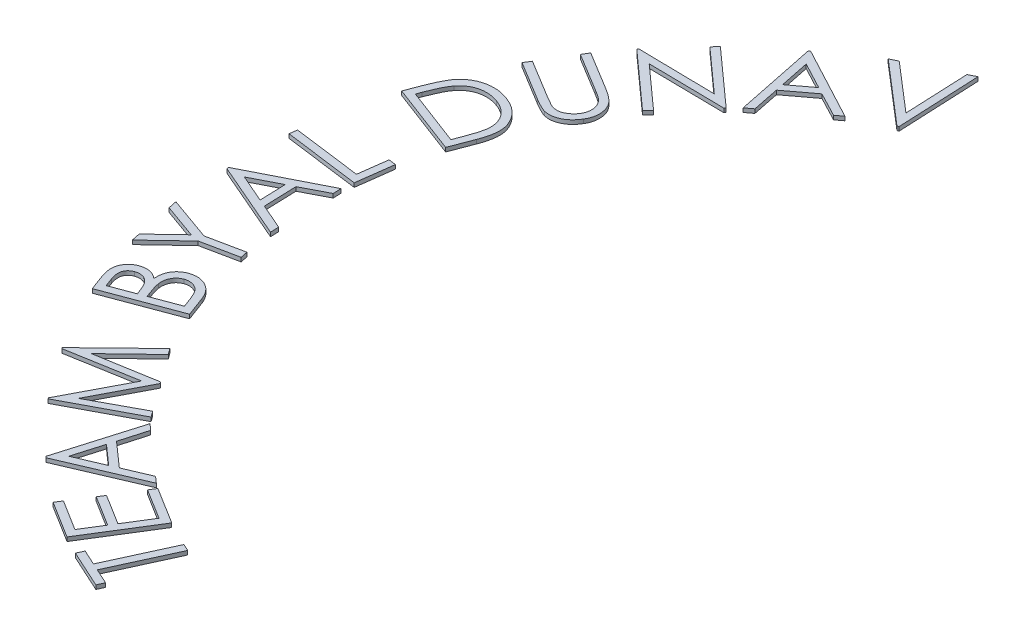
from build123d import *

# Parameters (mm, degrees)
BOSS_EXTRUDE1_DEPTH    = 1
BOSS_EXTRUDE1_2_DEPTH  = 1
BOSS_EXTRUDE1_3_DEPTH  = 1
BOSS_EXTRUDE1_4_DEPTH  = 1
BOSS_EXTRUDE1_5_DEPTH  = 1
BOSS_EXTRUDE1_6_DEPTH  = 1
BOSS_EXTRUDE1_7_DEPTH  = 1
BOSS_EXTRUDE1_8_DEPTH  = 1
BOSS_EXTRUDE1_9_DEPTH  = 1
BOSS_EXTRUDE1_10_DEPTH = 1
BOSS_EXTRUDE1_11_DEPTH = 1
BOSS_EXTRUDE1_12_DEPTH = 1
BOSS_EXTRUDE1_13_DEPTH = 1


with BuildPart() as part:
    # Sketch2 → Boss-Extrude1 (new body)
    with BuildSketch(Plane(origin=(0, 0, 0), x_dir=(1, 0, 0), z_dir=(0, 1, 0))):
        Polygon((-59.509999225, 102.840676539), (-57.659187927, 103.748909712), (-45.585029273, 93.353837597), (-46.287192735, 109.320424135), (-44.436381437, 110.224841202), (-43.505251629, 89.583525097), (-43.875413889, 89.40035202), align=None)
    extrude(amount=BOSS_EXTRUDE1_DEPTH)


with BuildPart() as body_2:
    # Sketch2 → Boss-Extrude1 2 (new body)
    with BuildSketch(Plane(origin=(0, 0, 0), x_dir=(1, 0, 0), z_dir=(0, 1, 0))):
        Polygon((-70.882797595, 94.826390165), (-52.515880527, 85.026630549), (-54.137725479, 83.809292809), (-60.235862499, 86.99192502), (-66.734690624, 82.111125742), (-65.368524758, 75.375699059), (-67.047611297, 74.112568049), (-71.249143749, 94.551630549), align=None)
        Polygon((-68.661824037, 91.491113722), (-67.150646152, 84.072604107), (-61.991271152, 87.949767569), align=None, mode=Mode.SUBTRACT)
    extrude(amount=BOSS_EXTRUDE1_2_DEPTH)


with BuildPart() as body_3:
    # Sketch2 → Boss-Extrude1 3 (new body)
    with BuildSketch(Plane(origin=(0, 0, 0), x_dir=(1, 0, 0), z_dir=(0, 1, 0))):
        Polygon((-79.039260453, 60.934708937), (-93.074897472, 73.527857976), (-92.800137857, 73.833146437), (-73.685264059, 73.52404187), (-84.427601799, 83.163525043), (-83.187367424, 84.548771437), (-69.151730405, 71.955622399), (-69.434122232, 71.63888562), (-88.346742424, 71.906013024), (-77.737968386, 62.38482913), align=None)
    extrude(amount=BOSS_EXTRUDE1_3_DEPTH)


with BuildPart() as body_4:
    # Sketch2 → Boss-Extrude1 4 (new body)
    with BuildSketch(Plane(origin=(0, 0, 0), x_dir=(1, 0, 0), z_dir=(0, 1, 0))):
        with BuildLine():
            Line((-104.499431884, 56.255693242), (-103.518692701, 57.869905982))
            Line((-103.518692701, 57.869905982), (-93.776174673, 51.947309828))
            add(Edge.make_bspline(
                [(-93.776174673, 51.947309828), (-93.638665943, 51.864846246), (-93.376370355, 51.70754835), (-93.005122207, 51.480313825), (-92.667282037, 51.288754578), (-92.375369022, 51.114017942), (-92.119570782, 50.973840218), (-91.9038497, 50.859610845), (-91.731002375, 50.764857281), (-91.624194765, 50.719163979), (-91.57809775, 50.699443242)],
                knots=[0, 0, 0, 0, 1.521709966, 2.902636155, 4.13049615, 5.207150739, 6.131121623, 6.898057724, 7.524413563, 8, 8, 8, 8], degree=3))
            add(Edge.make_bspline(
                [(-91.57809775, 50.699443242), (-91.410305099, 50.629417195), (-91.086593203, 50.494320312), (-90.591709762, 50.360433242), (-90.112999506, 50.284684407), (-89.641435549, 50.275869258), (-89.171204552, 50.337314309), (-88.698451177, 50.479666561), (-88.216705189, 50.692737556), (-87.738955393, 50.977867454), (-87.274566031, 51.307454761), (-86.863094519, 51.690822701), (-86.492591548, 52.096475652), (-86.295285658, 52.399769547), (-86.197388615, 52.55025454)],
                knots=[0, 0, 0, 0, 1.04464136, 2.015361418, 2.940265212, 3.825526239, 4.718371229, 5.655888648, 6.654889998, 7.740132546, 8.850743932, 9.922490505, 10.969204441, 12, 12, 12, 12], degree=3))
            add(Edge.make_bspline(
                [(-86.197388615, 52.55025454), (-86.121692682, 52.684797732), (-85.970633729, 52.953292393), (-85.80138256, 53.38363858), (-85.672523705, 53.829066949), (-85.597946716, 54.289033113), (-85.571204897, 54.753244798), (-85.592359664, 55.21308788), (-85.670281038, 55.662284208), (-85.797077846, 56.09989206), (-85.973367807, 56.527021931), (-86.204766379, 56.938887793), (-86.483309679, 57.340372854), (-86.705812101, 57.584822381), (-86.819413855, 57.70962954)],
                knots=[0, 0, 0, 0, 0.990874178, 1.977390469, 2.963093864, 3.965463137, 4.964227234, 5.94623026, 6.916359231, 7.886350478, 8.868387516, 9.878160084, 10.916664659, 12, 12, 12, 12], degree=3))
            add(Edge.make_bspline(
                [(-86.819413855, 57.70962954), (-86.868333086, 57.758712213), (-86.97718273, 57.867925532), (-87.174138963, 58.030224245), (-87.414034693, 58.210884157), (-87.693850472, 58.415161675), (-88.018787216, 58.635946114), (-88.389841069, 58.874367541), (-88.799597465, 59.138973021), (-89.09081023, 59.315670908), (-89.242641019, 59.407796607)],
                knots=[0, 0, 0, 0, 0.560704202, 1.247616779, 2.063182767, 2.992107026, 4.051724073, 5.242738598, 6.56243536, 8, 8, 8, 8], degree=3))
            Line((-89.242641019, 59.407796607), (-98.985159048, 65.330392761))
            Line((-98.985159048, 65.330392761), (-98.004419865, 66.940789395))
            Line((-98.004419865, 66.940789395), (-88.261901836, 61.018193242))
            add(Edge.make_bspline(
                [(-88.261901836, 61.018193242), (-88.086971786, 60.909824521), (-87.745875474, 60.698516225), (-87.257415416, 60.37193122), (-86.798135334, 60.055055988), (-86.378755062, 59.731318814), (-85.989020524, 59.417789842), (-85.635785824, 59.102364508), (-85.315790717, 58.790771037), (-85.025502516, 58.479494042), (-84.76458258, 58.159205927), (-84.536202316, 57.818648591), (-84.334421719, 57.459620177), (-84.155965181, 57.081767421), (-84.008421564, 56.683285266), (-83.891379951, 56.263913644), (-83.794671837, 55.827281248), (-83.726516753, 55.373574613), (-83.690624145, 54.910540447), (-83.698294619, 54.445496132), (-83.749588374, 53.982401297), (-83.836224116, 53.519797065), (-83.967015919, 53.060175613), (-84.140808971, 52.603918658), (-84.353740639, 52.149579985), (-84.523723032, 51.855809852), (-84.609888615, 51.706895165)],
                knots=[0, 0, 0, 0, 1.301313133, 2.537432011, 3.715840394, 4.829298439, 5.887227662, 6.878679763, 7.823058178, 8.711138056, 9.56927067, 10.432779, 11.300921843, 12.171855851, 13.072958123, 13.984628358, 14.923542628, 15.899732613, 16.883879229, 17.857446871, 18.836483572, 19.827347991, 20.830739474, 21.854247403, 22.912298972, 24, 24, 24, 24], degree=3))
            add(Edge.make_bspline(
                [(-84.609888615, 51.706895165), (-84.709561214, 51.549023453), (-84.905831154, 51.23815094), (-85.231996912, 50.802758111), (-85.575574271, 50.400596996), (-85.937451681, 50.034116249), (-86.319075141, 49.702683888), (-86.717688914, 49.405605869), (-87.136636688, 49.144512133), (-87.570488459, 48.919908557), (-88.014572393, 48.733256788), (-88.463092156, 48.588510869), (-88.911653691, 48.478823616), (-89.362904062, 48.415625027), (-89.816032109, 48.387075521), (-90.270792923, 48.403179492), (-90.726792199, 48.459801991), (-91.026516837, 48.528060672), (-91.177406644, 48.562424011)],
                knots=[0, 0, 0, 0, 1.145609015, 2.255871866, 3.335626846, 4.390132264, 5.414016459, 6.4352776, 7.438349948, 8.4405711, 9.430952593, 10.391429682, 11.330728498, 12.261552068, 13.184483259, 14.114127243, 15.05059865, 16, 16, 16, 16], degree=3))
            add(Edge.make_bspline(
                [(-91.177406644, 48.562424011), (-91.278351437, 48.590255424), (-91.496900669, 48.650511468), (-91.839805232, 48.780294058), (-92.224549531, 48.943904019), (-92.649515452, 49.149385607), (-93.118035167, 49.389308951), (-93.628456938, 49.667686714), (-94.179361718, 49.986685897), (-94.558793045, 50.214265797), (-94.756913855, 50.333097088)],
                knots=[0, 0, 0, 0, 0.62717544, 1.357858157, 2.194593729, 3.132186333, 4.185575029, 5.348717276, 6.615627533, 8, 8, 8, 8], degree=3))
            Line((-94.756913855, 50.333097088), (-104.499431884, 56.255693242))
        make_face()
    extrude(amount=BOSS_EXTRUDE1_4_DEPTH)


with BuildPart() as body_5:
    # Sketch2 → Boss-Extrude1 5 (new body)
    with BuildSketch(Plane(origin=(0, 0, 0), x_dir=(1, 0, 0), z_dir=(0, 1, 0))):
        with BuildLine():
            Line((-95.689548795, 28.344220606), (-113.407727881, 35.075831183))
            Line((-113.407727881, 35.075831183), (-112.014849276, 38.750741039))
            add(Edge.make_bspline(
                [(-112.014849276, 38.750741039), (-111.891763651, 39.069375444), (-111.653835239, 39.685305841), (-111.284778521, 40.564612679), (-110.921029484, 41.36831356), (-110.568875525, 42.098390295), (-110.218089343, 42.751251713), (-109.874376722, 43.330067689), (-109.540134766, 43.835904002), (-109.299942955, 44.133059722), (-109.187114901, 44.272646087)],
                knots=[0, 0, 0, 0, 1.316133939, 2.544128586, 3.67384615, 4.715091503, 5.666834921, 6.528436877, 7.308745772, 8, 8, 8, 8], degree=3))
            add(Edge.make_bspline(
                [(-109.187114901, 44.272646087), (-109.028757179, 44.453798851), (-108.7156916, 44.811929129), (-108.195743548, 45.289867262), (-107.656382445, 45.727758862), (-107.082744498, 46.106260818), (-106.485545922, 46.443130105), (-105.85678107, 46.719992151), (-105.20291839, 46.950903108), (-104.523337032, 47.125163935), (-103.825327294, 47.24699598), (-103.113458083, 47.315403681), (-102.391380797, 47.331430739), (-101.660325006, 47.288601361), (-100.920530824, 47.188544866), (-100.172804227, 47.030003876), (-99.41394814, 46.820896296), (-98.913104428, 46.641874584), (-98.658479083, 46.550861231)],
                knots=[0, 0, 0, 0, 1.000158699, 1.977265517, 2.933358386, 3.887252495, 4.832374469, 5.782224299, 6.741109625, 7.71389456, 8.69688624, 9.685656974, 10.685927639, 11.698231503, 12.728668114, 13.788200965, 14.87553726, 16, 16, 16, 16], degree=3))
            add(Edge.make_bspline(
                [(-98.658479083, 46.550861231), (-98.441207023, 46.464238802), (-98.013023468, 46.293529784), (-97.396727425, 45.999016838), (-96.816054238, 45.672471952), (-96.264631876, 45.324364186), (-95.75251828, 44.939021457), (-95.269302889, 44.530343387), (-94.818867961, 44.093035048), (-94.408326954, 43.625589402), (-94.031409775, 43.145424347), (-93.698092555, 42.649374618), (-93.403598823, 42.146574974), (-93.150462382, 41.634095575), (-92.940417261, 41.111909715), (-92.766091867, 40.582551336), (-92.642790541, 40.041596046), (-92.55078186, 39.49019994), (-92.510580178, 38.915545035), (-92.51427999, 38.31075579), (-92.570574321, 37.672169915), (-92.670986178, 36.99959486), (-92.816370317, 36.292267074), (-93.013584413, 35.55035789), (-93.256891798, 34.773641685), (-93.449768997, 34.249492943), (-93.548713458, 33.980608827)],
                knots=[0, 0, 0, 0, 1.08941687, 2.146941435, 3.178906015, 4.191480947, 5.182251892, 6.161777583, 7.138143621, 8.103642226, 9.057836935, 9.979841647, 10.885380493, 11.770506287, 12.639800862, 13.505553849, 14.363648038, 15.221905892, 16.107230015, 17.043500928, 18.036555145, 19.09078746, 20.209919199, 21.398554277, 22.665479135, 24, 24, 24, 24], degree=3))
            Line((-93.548713458, 33.980608827), (-95.689548795, 28.344220606))
        make_face()
        with BuildLine():
            Line((-96.719897353, 30.679677337), (-95.941411776, 32.728926135))
            add(Edge.make_bspline(
                [(-95.941411776, 32.728926135), (-95.830674405, 33.023553737), (-95.618025832, 33.589326057), (-95.333471211, 34.41096168), (-95.081740604, 35.164787888), (-94.880420654, 35.85691538), (-94.715342135, 36.482774384), (-94.5858981, 37.042987596), (-94.503182268, 37.540310478), (-94.476795606, 37.851209111), (-94.464578843, 37.995152097)],
                knots=[0, 0, 0, 0, 1.376935321, 2.644123925, 3.80385366, 4.853417381, 5.796930699, 6.635348854, 7.368180047, 8, 8, 8, 8], degree=3))
            add(Edge.make_bspline(
                [(-94.464578843, 37.995152097), (-94.458690282, 38.17963671), (-94.447021261, 38.545219229), (-94.488223392, 39.087693208), (-94.567370461, 39.616117915), (-94.689911815, 40.129378721), (-94.854625935, 40.627227698), (-95.061719991, 41.111628478), (-95.314700817, 41.580617935), (-95.607663216, 42.034085047), (-95.941387547, 42.466164687), (-96.310322971, 42.875780169), (-96.723134348, 43.254058014), (-97.168148806, 43.60918611), (-97.652360373, 43.934932679), (-98.174156344, 44.231410069), (-98.729225107, 44.508645076), (-99.120250771, 44.663467139), (-99.318665381, 44.742027097)],
                knots=[0, 0, 0, 0, 0.990878398, 1.963566578, 2.917375225, 3.858742624, 4.794363934, 5.731057532, 6.684866179, 7.653369286, 8.627831877, 9.614673325, 10.610744832, 11.631997475, 12.670545156, 13.74182267, 14.854153532, 16, 16, 16, 16], degree=3))
            add(Edge.make_bspline(
                [(-99.318665381, 44.742027097), (-99.530100077, 44.818869342), (-99.944928264, 44.969631398), (-100.575662062, 45.140329311), (-101.196087416, 45.268283192), (-101.809913687, 45.343902129), (-102.413284404, 45.37675048), (-103.009156604, 45.355839403), (-103.596618304, 45.292983669), (-104.173307767, 45.17732797), (-104.732278767, 45.017893508), (-105.270725445, 44.815634631), (-105.782542164, 44.565133233), (-106.275151688, 44.276815895), (-106.735078703, 43.932839641), (-107.177551669, 43.554259429), (-107.595853409, 43.129614536), (-107.848926453, 42.817096139), (-107.977409372, 42.658433347)],
                knots=[0, 0, 0, 0, 1.124724929, 2.206674747, 3.264736099, 4.290593839, 5.297093281, 6.283731661, 7.269446559, 8.248900009, 9.221552481, 10.173935632, 11.121461393, 12.06853851, 13.024167382, 13.989572764, 14.979324093, 16, 16, 16, 16], degree=3))
            add(Edge.make_bspline(
                [(-107.977409372, 42.658433347), (-108.075970715, 42.524883272), (-108.285871448, 42.24046894), (-108.579682561, 41.758986613), (-108.889632275, 41.208226574), (-109.208678035, 40.582925406), (-109.5352539, 39.882898912), (-109.87516839, 39.112470591), (-110.222235894, 38.266967064), (-110.45010504, 37.676315354), (-110.568545189, 37.36931075)],
                knots=[0, 0, 0, 0, 0.674113054, 1.435621913, 2.289532721, 3.241863304, 4.286913261, 5.427769638, 6.663025015, 8, 8, 8, 8], degree=3))
            Line((-110.568545189, 37.36931075), (-111.041742304, 36.117628058))
            Line((-111.041742304, 36.117628058), (-96.719897353, 30.679677337))
        make_face(mode=Mode.SUBTRACT)
    extrude(amount=BOSS_EXTRUDE1_5_DEPTH)


with BuildPart() as body_6:
    # Sketch2 → Boss-Extrude1 6 (new body)
    with BuildSketch(Plane(origin=(0, 0, 0), x_dir=(1, 0, 0), z_dir=(0, 1, 0))):
        Polygon((-118.227866664, 11.712707654), (-117.979819789, 13.597863904), (-101.021045751, 11.365442029), (-100.070835414, 18.577881933), (-98.258185174, 18.337467269), (-99.456442386, 9.239871116), align=None)
    extrude(amount=BOSS_EXTRUDE1_6_DEPTH)


with BuildPart() as body_7:
    # Sketch2 → Boss-Extrude1 7 (new body)
    with BuildSketch(Plane(origin=(0, 0, 0), x_dir=(1, 0, 0), z_dir=(0, 1, 0))):
        Polygon((-118.492967901, -3.125339439), (-99.839842901, 6.338602869), (-99.771152997, 4.304618494), (-105.907451074, 1.121986282), (-105.636507564, -7.044480064), (-99.301771987, -9.799708429), (-99.229265978, -11.913831025), (-118.477703478, -3.590904343), align=None)
        Polygon((-114.466976314, -3.224558189), (-107.491134968, -6.254546169), (-107.708652997, 0.225201427), align=None, mode=Mode.SUBTRACT)
    extrude(amount=BOSS_EXTRUDE1_7_DEPTH)


with BuildPart() as body_8:
    # Sketch2 → Boss-Extrude1 8 (new body)
    with BuildSketch(Plane(origin=(0, 0, 0), x_dir=(1, 0, 0), z_dir=(0, 1, 0))):
        Polygon((-114.808098587, -30.887362159), (-115.254582962, -28.738894611), (-108.576397866, -22.400342928), (-117.208429116, -19.309297255), (-117.651097385, -17.160829707), (-106.725586568, -21.041809274), (-97.837876231, -19.202446294), (-97.456265654, -21.034177063), (-106.343975991, -22.873540044), align=None)
    extrude(amount=BOSS_EXTRUDE1_8_DEPTH)


with BuildPart() as body_9:
    # Sketch2 → Boss-Extrude1 9 (new body)
    with BuildSketch(Plane(origin=(0, 0, 0), x_dir=(1, 0, 0), z_dir=(0, 1, 0))):
        with BuildLine():
            Line((-109.292948545, -46.423198533), (-110.598056718, -42.931461754))
            add(Edge.make_bspline(
                [(-110.598056718, -42.931461754), (-110.660237532, -42.760127487), (-110.780748279, -42.428069744), (-110.937794728, -41.938157274), (-111.068323957, -41.472417643), (-111.17175422, -41.030608778), (-111.248406023, -40.614245781), (-111.301158366, -40.223365753), (-111.318315684, -39.855903114), (-111.316547234, -39.40325996), (-111.242539926, -38.864480043), (-111.07210191, -38.249278642), (-110.808756537, -37.668284769), (-110.455664642, -37.131891839), (-110.031482985, -36.645202688), (-109.541494452, -36.22587337), (-108.994452483, -35.874075477), (-108.592507191, -35.707932171), (-108.388531478, -35.623619206)],
                knots=[0, 0, 0, 0, 1.009590489, 1.956656686, 2.849064851, 3.688285233, 4.469154299, 5.193691134, 5.871053148, 6.505259619, 7.699145516, 8.870295445, 10.030776944, 11.217090747, 12.415542507, 13.594825153, 14.779442711, 16, 16, 16, 16], degree=3))
            add(Edge.make_bspline(
                [(-108.388531478, -35.623619206), (-108.192791177, -35.558494531), (-107.807115762, -35.430176623), (-107.209396986, -35.331908863), (-106.612084829, -35.315202538), (-106.018060516, -35.386716864), (-105.431422544, -35.532379616), (-104.865754652, -35.775539207), (-104.317494862, -36.096873154), (-103.983886316, -36.369383172), (-103.81302066, -36.508955745)],
                knots=[0, 0, 0, 0, 1.00769012, 1.985494574, 2.950147326, 3.920959711, 4.903286262, 5.895863318, 6.922315693, 8, 8, 8, 8], degree=3))
            add(Edge.make_bspline(
                [(-103.81302066, -36.508955745), (-103.816695206, -36.260870788), (-103.8236953, -35.788263269), (-103.776535165, -35.113575811), (-103.674041066, -34.511888873), (-103.526571767, -33.972441956), (-103.31782459, -33.488867013), (-103.06870877, -33.037832979), (-102.769897232, -32.616040523), (-102.421113434, -32.227808293), (-102.033464129, -31.871832485), (-101.602065873, -31.560668335), (-101.131997947, -31.295614369), (-100.796128211, -31.159034606), (-100.626572343, -31.090085552)],
                knots=[0, 0, 0, 0, 1.317262085, 2.509414404, 3.585548215, 4.554276404, 5.471441189, 6.375577405, 7.286501713, 8.209889511, 9.142326008, 10.076034054, 11.028731436, 12, 12, 12, 12], degree=3))
            add(Edge.make_bspline(
                [(-100.626572343, -31.090085552), (-100.450873381, -31.029077395), (-100.104168061, -30.908690498), (-99.571252404, -30.795524293), (-99.040694011, -30.738373243), (-98.512127443, -30.731695458), (-97.986601765, -30.791873737), (-97.4642118, -30.903893042), (-96.942385708, -31.067144651), (-96.429661283, -31.293878239), (-95.933720777, -31.568748348), (-95.464661169, -31.896362057), (-95.035847524, -32.280131083), (-94.634020242, -32.709580413), (-94.274428604, -33.194306887), (-93.937171292, -33.722712252), (-93.646436204, -34.308653059), (-93.480044711, -34.721845366), (-93.39505191, -34.932904062)],
                knots=[0, 0, 0, 0, 0.972155306, 1.918346088, 2.841995135, 3.760259829, 4.677294203, 5.602571586, 6.551659068, 7.531977791, 8.529843563, 9.513768732, 10.517804944, 11.534788235, 12.584779756, 13.670265978, 14.809971494, 16, 16, 16, 16], degree=3))
            Line((-93.39505191, -34.932904062), (-91.574769459, -39.798438918))
            Line((-91.574769459, -39.798438918), (-109.292948545, -46.423198533))
        make_face()
        with BuildLine():
            Line((-108.205358401, -44.041948533), (-102.534625228, -41.920193726))
            Line((-102.534625228, -41.920193726), (-102.912419699, -40.908925697))
            add(Edge.make_bspline(
                [(-102.912419699, -40.908925697), (-102.968854567, -40.761056889), (-103.07793918, -40.475236927), (-103.249032887, -40.066335037), (-103.423241711, -39.692738573), (-103.585187914, -39.348384714), (-103.761663379, -39.046628763), (-103.926929731, -38.774183252), (-104.094668952, -38.536504424), (-104.316490395, -38.269099953), (-104.610078259, -37.984830227), (-104.995808072, -37.704940998), (-105.417141693, -37.492236383), (-105.866022407, -37.350655423), (-106.326921591, -37.267218732), (-106.791319394, -37.261927586), (-107.254831015, -37.319158867), (-107.551496991, -37.417188085), (-107.701632439, -37.466798293)],
                knots=[0, 0, 0, 0, 1.135575477, 2.194987193, 3.179196994, 4.09351406, 4.923296425, 5.685640205, 6.379513893, 7.008201079, 8.176461659, 9.301091486, 10.415378473, 11.546801923, 12.66764798, 13.763010953, 14.867914145, 16, 16, 16, 16], degree=3))
            add(Edge.make_bspline(
                [(-107.701632439, -37.466798293), (-107.799367469, -37.505245212), (-107.990463755, -37.5804185), (-108.254048709, -37.729306163), (-108.497288701, -37.890135072), (-108.707385235, -38.081563626), (-108.896678445, -38.285739413), (-109.054278833, -38.515878128), (-109.187863725, -38.763786233), (-109.296615295, -39.033265837), (-109.371148878, -39.32451974), (-109.419633421, -39.637676024), (-109.423058933, -39.974446698), (-109.399433811, -40.334009275), (-109.347239359, -40.717569887), (-109.250657185, -41.122626788), (-109.131732855, -41.553308876), (-109.026589207, -41.843254723), (-108.97239566, -41.992699735)],
                knots=[0, 0, 0, 0, 0.9425185, 1.842858033, 2.714668915, 3.556597629, 4.390026915, 5.211218381, 6.055007029, 6.916719665, 7.814952798, 8.750864372, 9.756939084, 10.833518802, 11.987637137, 13.229853215, 14.572200211, 16, 16, 16, 16], degree=3))
            Line((-108.97239566, -41.992699735), (-108.205358401, -44.041948533))
        make_face(mode=Mode.SUBTRACT)
        with BuildLine():
            Line((-100.752503834, -41.256191322), (-93.959835564, -38.714664879))
            Line((-93.959835564, -38.714664879), (-94.780298305, -36.520404062))
            add(Edge.make_bspline(
                [(-94.780298305, -36.520404062), (-94.838860707, -36.364727387), (-94.952416385, -36.062861862), (-95.136645294, -35.634154504), (-95.314907232, -35.239853671), (-95.492651207, -34.882862336), (-95.678009146, -34.567088406), (-95.85481497, -34.283008799), (-96.035071532, -34.037100515), (-96.271494828, -33.76005691), (-96.584796743, -33.46340207), (-97.003799505, -33.17893237), (-97.457073435, -32.953004599), (-97.944123677, -32.806178187), (-98.441110791, -32.714340818), (-98.939194079, -32.703496394), (-99.429383336, -32.765999303), (-99.741192957, -32.867203768), (-99.897696141, -32.918000216)],
                knots=[0, 0, 0, 0, 1.126802224, 2.184930691, 3.160703435, 4.058780215, 4.885136204, 5.640681463, 6.325035912, 6.948563119, 8.107056588, 9.235406912, 10.368618289, 11.524415643, 12.670726658, 13.782831337, 14.88716084, 16, 16, 16, 16], degree=3))
            add(Edge.make_bspline(
                [(-99.897696141, -32.918000216), (-100.085735259, -32.999063301), (-100.455093905, -33.158292676), (-100.943806546, -33.511479775), (-101.359563049, -33.944860893), (-101.688482884, -34.460195785), (-101.940211823, -35.033637759), (-102.085114227, -35.661838316), (-102.147391433, -36.333308364), (-102.105795603, -36.79145887), (-102.084324747, -37.027946129)],
                knots=[0, 0, 0, 0, 0.972358278, 1.909969274, 2.847912614, 3.815337382, 4.805241621, 5.814223033, 6.871749794, 8, 8, 8, 8], degree=3))
            add(Edge.make_bspline(
                [(-102.084324747, -37.027946129), (-102.071395954, -37.117181677), (-102.043544598, -37.309413941), (-101.974993846, -37.614004281), (-101.892826394, -37.959976152), (-101.779168913, -38.342782978), (-101.650789413, -38.767224492), (-101.497096158, -39.228762347), (-101.320941996, -39.729791399), (-101.193120626, -40.075920549), (-101.126482199, -40.25637161)],
                knots=[0, 0, 0, 0, 0.641279734, 1.381452332, 2.219941119, 3.170931834, 4.22155995, 5.374903757, 6.631431636, 8, 8, 8, 8], degree=3))
            Line((-101.126482199, -40.25637161), (-100.752503834, -41.256191322))
        make_face(mode=Mode.SUBTRACT)
    extrude(amount=BOSS_EXTRUDE1_9_DEPTH)


with BuildPart() as body_10:
    # Sketch2 → Boss-Extrude1 10 (new body)
    with BuildSketch(Plane(origin=(0, 0, 0), x_dir=(1, 0, 0), z_dir=(0, 1, 0))):
        Polygon((-74.115821994, -66.89272179), (-90.948664542, -75.814777078), (-91.131837619, -75.566730203), (-83.118015504, -60.264146068), (-100.099686177, -63.22162804), (-100.282859254, -62.969765059), (-86.613568388, -49.693533088), (-85.518346033, -51.197078761), (-95.348634494, -60.622860011), (-80.515431369, -58.085149674), (-80.233039542, -58.470576357), (-87.258490263, -71.929981405), (-75.184331609, -65.419704963), align=None)
    extrude(amount=BOSS_EXTRUDE1_10_DEPTH)


with BuildPart() as body_11:
    # Sketch2 → Boss-Extrude1 11 (new body)
    with BuildSketch(Plane(origin=(0, 0, 0), x_dir=(1, 0, 0), z_dir=(0, 1, 0))):
        Polygon((-78.765771278, -88.526475821), (-72.824094595, -68.453759475), (-71.297652288, -69.804660917), (-73.201889066, -76.456133273), (-67.077039307, -81.875003466), (-60.719407095, -79.165568369), (-59.135723201, -80.566079187), (-78.418505653, -88.835580389), align=None)
        Polygon((-75.930404691, -85.6682126), (-68.927850605, -82.684017889), (-73.789569355, -78.383266687), align=None, mode=Mode.SUBTRACT)
    extrude(amount=BOSS_EXTRUDE1_11_DEPTH)


with BuildPart() as body_12:
    # Sketch2 → Boss-Extrude1 12 (new body)
    with BuildSketch(Plane(origin=(0, 0, 0), x_dir=(1, 0, 0), z_dir=(0, 1, 0))):
        Polygon((-58.666027928, -103.366138726), (-67.912452207, -97.607635121), (-66.920264707, -96.016319015), (-59.284237063, -100.771186803), (-56.143582015, -95.726294976), (-63.714735861, -91.013404351), (-62.730180572, -89.433536563), (-55.159026726, -94.146427188), (-51.220805572, -87.815507717), (-58.791959419, -83.102617092), (-57.799771919, -81.511300986), (-48.618221438, -87.227827428), align=None)
    extrude(amount=BOSS_EXTRUDE1_12_DEPTH)


with BuildPart() as body_13:
    # Sketch2 → Boss-Extrude1 13 (new body)
    with BuildSketch(Plane(origin=(0, 0, 0), x_dir=(1, 0, 0), z_dir=(0, 1, 0))):
        Polygon((-43.915895778, -108.473236199), (-44.682933038, -110.144690526), (-54.116346499, -105.824858796), (-53.34930924, -104.153404469), (-49.514122941, -105.908813123), (-42.412350105, -90.388710959), (-40.660757557, -91.190093171), (-47.762530393, -106.710195334), align=None)
    extrude(amount=BOSS_EXTRUDE1_13_DEPTH)


solid = Compound([part.part, body_2.part, body_3.part, body_4.part, body_5.part, body_6.part, body_7.part, body_8.part, body_9.part, body_10.part, body_11.part, body_12.part, body_13.part])
